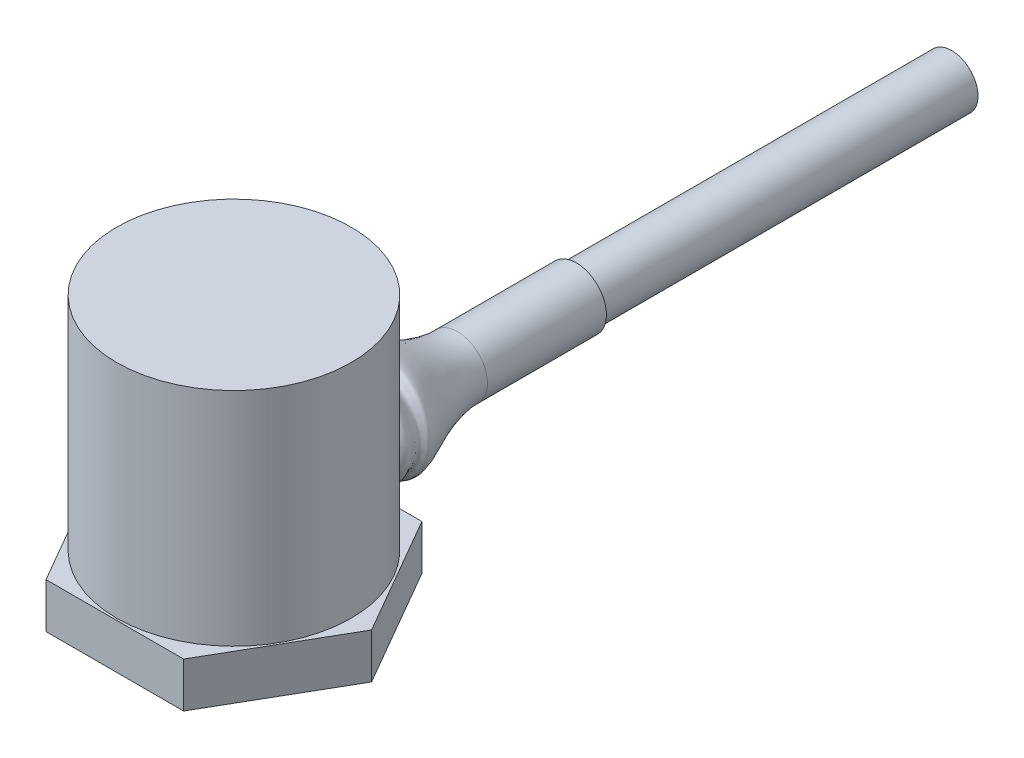
from build123d import *

# Parameters (mm, degrees)
SZKIC1_R                    = 3.175
DODANIE_WYCI_GNI_CIE1_DEPTH = 1.2
SZKIC2_R                    = 3.125
DODANIE_WYCI_GNI_CIE2_DEPTH = 5.9
SZKIC4_R                    = 0.7
DODANIE_WYCI_GNI_CIE3_DEPTH = 10


with BuildPart() as part:
    # Szkic1 → Dodanie-wyciągnięcie1 (new body)
    with BuildSketch(Plane(origin=(0, 0, 0), x_dir=(1, 0, 0), z_dir=(0, 1, 0))):
        Circle(SZKIC1_R)
        with BuildLine():
            ThreePointArc((1.5e-08, -3.175), (-1.587499982, -2.749630667), (-2.749630644, -1.587500022))
            Line((-2.749630644, -1.587500022), (-1.833087105, -3.175))
            Line((-1.833087105, -3.175), (1.5e-08, -3.175))
        make_face()
        with BuildLine():
            ThreePointArc((2.749630678, -1.587499964), (1.587500025, -2.749630643), (1.5e-08, -3.175))
            Line((1.5e-08, -3.175), (1.833087105, -3.175))
            Line((1.833087105, -3.175), (2.749630678, -1.587499964))
        make_face()
        with BuildLine():
            Line((3.666174209, 0), (2.749630648, 1.587500016))
            ThreePointArc((2.749630648, 1.587500016), (3.066814496, 0.821750477), (3.175, 0))
            ThreePointArc((3.175, 0), (3.066814504, -0.821750448), (2.749630678, -1.587499964))
            Line((2.749630678, -1.587499964), (3.666174209, 0))
        make_face()
        with BuildLine():
            ThreePointArc((-2.749630644, -1.587500022), (-3.175, -3.9e-08), (-2.749630684, 1.587499954))
            Line((-2.749630684, 1.587499954), (-3.666174209, 0))
            Line((-3.666174209, 0), (-2.749630644, -1.587500022))
        make_face()
        with BuildLine():
            Line((0, 3.175), (-1.833087105, 3.175))
            Line((-1.833087105, 3.175), (-2.749630684, 1.587499954))
            ThreePointArc((-2.749630684, 1.587499954), (-1.587500023, 2.749630644), (0, 3.175))
        make_face()
        with BuildLine():
            Line((1.833087105, 3.175), (0, 3.175))
            ThreePointArc((0, 3.175), (1.587499992, 2.749630662), (2.749630648, 1.587500016))
            Line((2.749630648, 1.587500016), (1.833087105, 3.175))
        make_face()
    extrude(amount=DODANIE_WYCI_GNI_CIE1_DEPTH)

    # Szkic2 → Dodanie-wyciągnięcie2 (add)
    with BuildSketch(Plane(origin=(0, 1.2, 0), x_dir=(1, 0, 0), z_dir=(0, 1, 0))):
        with Locations(Location((0, 0, 0), (0, 0, 270))):
            Circle(SZKIC2_R)
    extrude(amount=DODANIE_WYCI_GNI_CIE2_DEPTH)


with BuildPart() as body_2:
    # Szkic3 → Obrót6 (revolve)
    with BuildSketch(Plane(origin=(0, 0, 0), x_dir=(0, 0, -1), z_dir=(1, 0, 0)), mode=Mode.PRIVATE) as obr_t6_sk:
        with BuildLine():
            Line((2.625, 1.2), (3.125, 1.2))
            add(Edge.make_bspline(
                [(3.125, 1.2), (3.302341726, 0.994577387), (3.430972676, 1.212802375), (3.71726331, 1.221072779), (3.759645242, 1.037475503), (4.025322746, 1.089812703), (4.67233425, 1.373401445), (5.369312269, 1.691833029), (5.954686582, 1.675)],
                knots=[0, 0, 0, 0, 0.161889297, 0.19827122, 0.247726197, 0.302592126, 0.41924519, 1, 1, 1, 1], degree=3))
            Line((5.954686582, 1.675), (9.125, 1.675))
            Line((9.125, 1.675), (9.125, 2.475))
            Line((9.125, 2.475), (2.625, 2.475))
            Line((2.625, 2.475), (2.625, 1.2))
        make_face()
    revolve(obr_t6_sk.sketch.rotate(Axis((0, 2.475, -2.625), (0, 0, -1)), 270), axis=Axis((0, 2.475, -2.625), (0, 0, -1)))

    # Szkic4 → Dodanie-wyciągnięcie3 (add)
    with BuildSketch(Plane(origin=(0, 0, -9.125), x_dir=(-1, 0, 0), z_dir=(0, 0, -1))):
        with Locations(Location((0, 2.475, 0), (0, 0, 180))):
            Circle(SZKIC4_R)
    extrude(amount=DODANIE_WYCI_GNI_CIE3_DEPTH)


solid = Compound([part.part, body_2.part])
